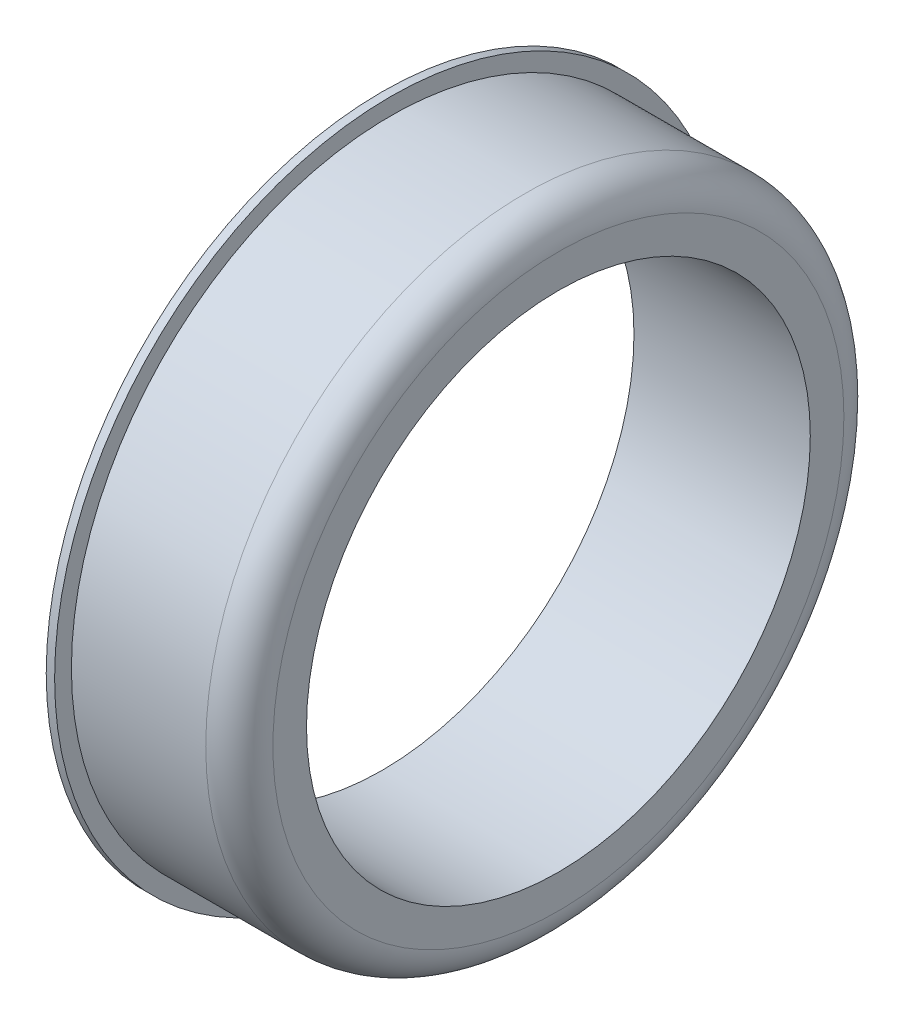
from build123d import *

# Parameters (mm, degrees)
SKETCH1_R           = 10
SKETCH1_R_2         = 7.5
BOSS_EXTRUDE1_DEPTH = 0.25
SKETCH2_R           = 9.5
SKETCH2_R_2         = 7.5
BOSS_EXTRUDE2_DEPTH = 5
FILLET1_R           = 1


with BuildPart() as part:
    # Sketch1 → Boss-Extrude1 (new body)
    with BuildSketch(Plane(origin=(0, 0, 0), x_dir=(0, 0, -1), z_dir=(1, 0, 0))):
        Circle(SKETCH1_R)
        Circle(SKETCH1_R_2, mode=Mode.SUBTRACT)
    extrude(amount=BOSS_EXTRUDE1_DEPTH)

    # Sketch2 → Boss-Extrude2 (add)
    with BuildSketch(Plane(origin=(0.25, 0, 0), x_dir=(0, 0, -1), z_dir=(1, 0, 0))):
        Circle(SKETCH2_R)
        Circle(SKETCH2_R_2, mode=Mode.SUBTRACT)
    extrude(amount=BOSS_EXTRUDE2_DEPTH)

    # Fillet1
    fillet1_edges = [part.edges().sort_by_distance(p)[0] for p in [
        (5.25, 0, 9.5),
    ]]
    fillet(fillet1_edges, radius=FILLET1_R)


solid = part.part
